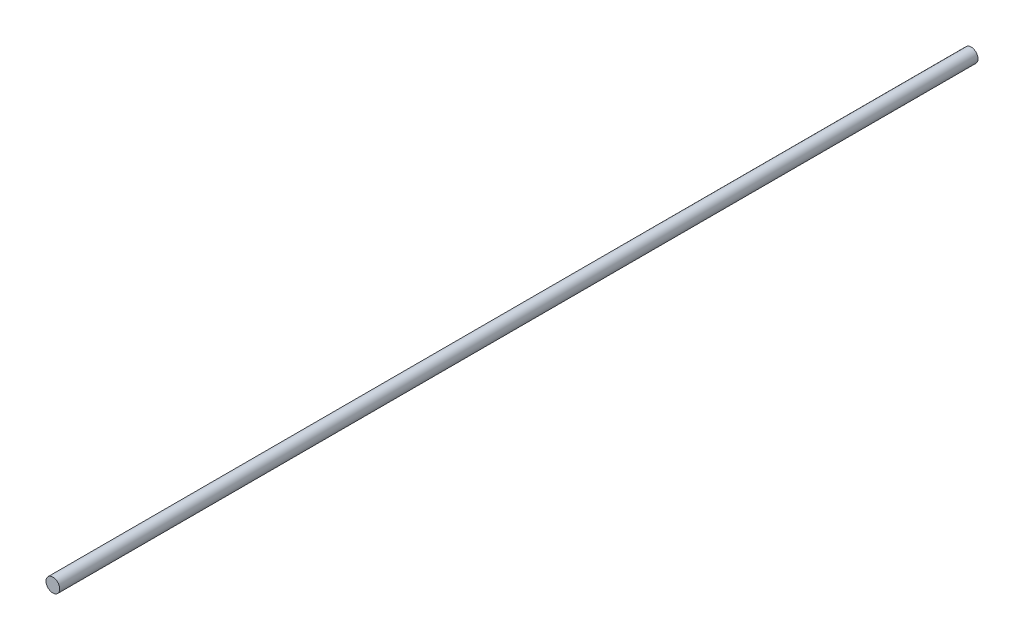
from build123d import *

# Parameters (mm, degrees)
SKETCH2_R           = 15
BOSS_EXTRUDE1_DEPTH = 2000


with BuildPart() as part:
    # Sketch2 → Boss-Extrude1 (new body)
    with BuildSketch(Plane.XY):
        Circle(SKETCH2_R)
    extrude(amount=BOSS_EXTRUDE1_DEPTH)


solid = part.part
